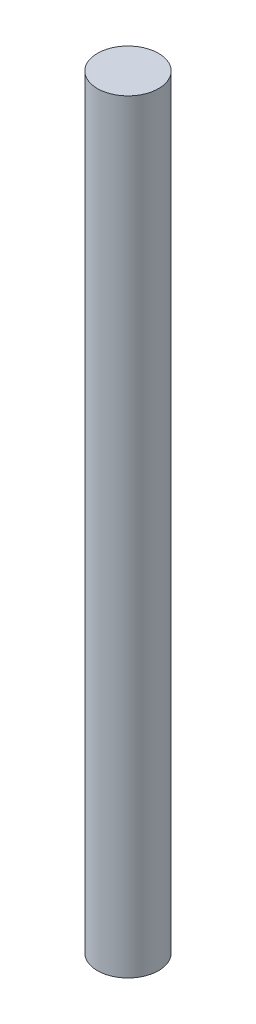
from build123d import *

# Parameters (mm, degrees)
CROQUIS1_R              = 4
SALIENTE_EXTRUIR1_DEPTH = 100


with BuildPart() as part:
    # Croquis1 → Saliente-Extruir1 (new body)
    with BuildSketch(Plane(origin=(0, 0, 0), x_dir=(1, 0, 0), z_dir=(0, 1, 0))):
        with Locations(Location((0, 0, 0), (0, 0, 270))):
            Circle(CROQUIS1_R)
    extrude(amount=SALIENTE_EXTRUIR1_DEPTH)


solid = part.part
